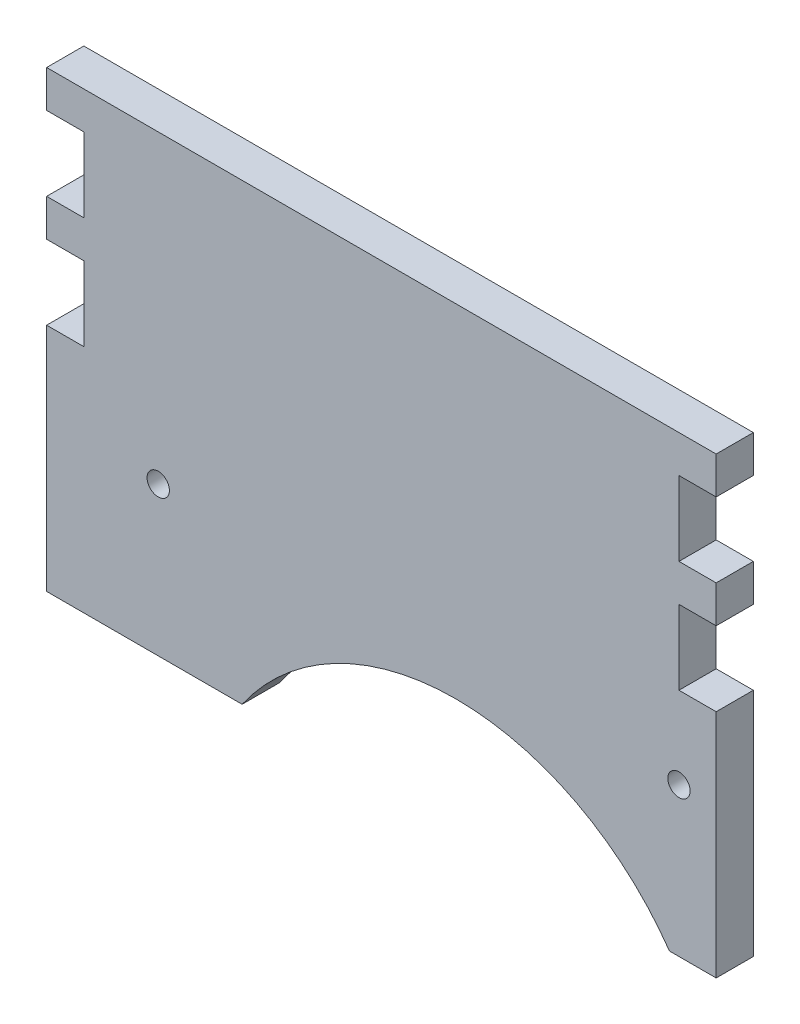
from build123d import *

# Parameters (mm, degrees)
ESQUISSE1_R        = 1.5
BOSS_EXTRU_1_DEPTH = 5


with BuildPart() as part:
    # Esquisse1 → Boss.-Extru.1 (new body)
    with BuildSketch(Plane.XY):
        with BuildLine():
            Line((0, 31), (0, 0))
            Line((0, 0), (26.277186767, 0))
            ThreePointArc((26.277186767, 0), (55, 15), (83.722813233, 0))
            Line((83.722813233, 0), (90, 0))
            Line((90, 0), (90, 31))
            Line((90, 31), (85, 31))
            Line((85, 31), (85, 41))
            Line((85, 41), (90, 41))
            Line((90, 41), (90, 46))
            Line((90, 46), (85, 46))
            Line((85, 46), (85, 56))
            Line((85, 56), (90, 56))
            Line((90, 56), (90, 61))
            Line((90, 61), (0, 61))
            Line((0, 61), (0, 56))
            Line((0, 56), (5, 56))
            Line((5, 56), (5, 46))
            Line((5, 46), (0, 46))
            Line((0, 46), (0, 41))
            Line((0, 41), (5, 41))
            Line((5, 41), (5, 31))
            Line((5, 31), (0, 31))
        make_face()
        with Locations((15, 20)):
            Circle(ESQUISSE1_R, mode=Mode.SUBTRACT)
        with Locations((85, 20)):
            Circle(ESQUISSE1_R, mode=Mode.SUBTRACT)
    extrude(amount=BOSS_EXTRU_1_DEPTH)


solid = part.part
